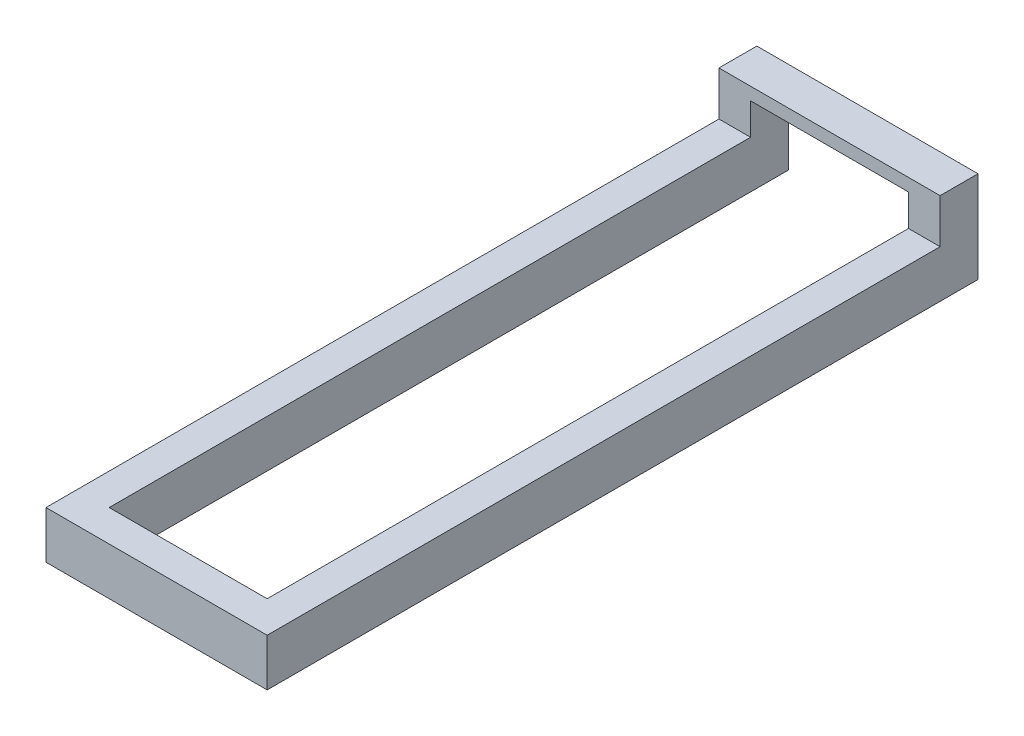
from build123d import *

# Parameters (mm, degrees)
BOSS_EXTRUDE1_DEPTH = 7.5
SKETCH2_W           = 10
SKETCH2_H           = 10
BOSS_EXTRUDE2_DEPTH = 12


with BuildPart() as part:
    # Sketch1 → Boss-Extrude1 (new, symmetric)
    with BuildSketch(Plane(origin=(0, 0, 0), x_dir=(1, 0, 0), z_dir=(0, 1, 0))):
        Polygon((25, 107.5), (35, 107.5), (35, -117.5), (-35, -117.5), (-35, 107.5), (-25, 107.5), (-25, -107.5), (25, -107.5), align=None)
    extrude(amount=BOSS_EXTRUDE1_DEPTH, both=True)

    # Sketch2 → Boss-Extrude2 (add)
    with BuildSketch(Plane(origin=(0, 0, -107.5), x_dir=(-1, 0, 0), z_dir=(0, 0, -1))):
        with Locations((-30, 12.5)):
            Rectangle(SKETCH2_W, SKETCH2_H)
        Polygon((-35, 21.5), (-35, 17.5), (-25, 17.5), (25, 17.5), (35, 17.5), (35, 21.5), align=None)
        with Locations((30, 12.5)):
            Rectangle(SKETCH2_W, SKETCH2_H)
    extrude(amount=-BOSS_EXTRUDE2_DEPTH)


solid = part.part
